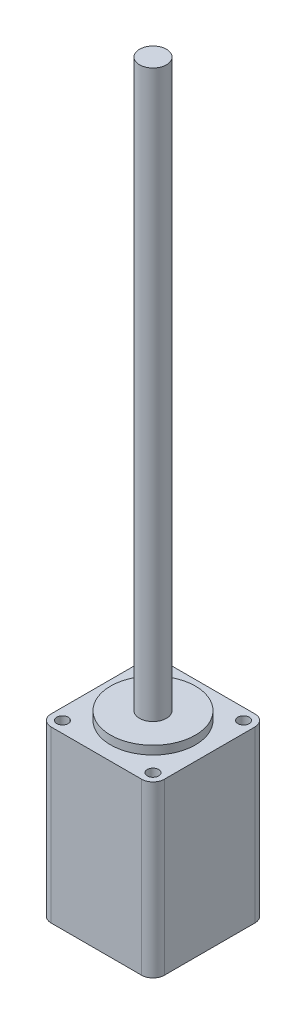
from build123d import *

# Parameters (mm, degrees)
SKETCH1_W           = 20
SKETCH1_H           = 20
BOSS_EXTRUDE1_DEPTH = 30
FILLET1_R           = 2
SKETCH2_R           = 1
CUT_EXTRUDE1_DEPTH  = 3
SKETCH3_R           = 7.5
BOSS_EXTRUDE2_DEPTH = 1.5
SKETCH4_R           = 2.38
BOSS_EXTRUDE3_DEPTH = 100


with BuildPart() as part:
    # Sketch1 → Boss-Extrude1 (new body)
    with BuildSketch(Plane(origin=(0, 0, 0), x_dir=(1, 0, 0), z_dir=(0, 1, 0))):
        Rectangle(SKETCH1_W, SKETCH1_H)
    extrude(amount=BOSS_EXTRUDE1_DEPTH)

    # Fillet1
    fillet1_edges = [part.edges().sort_by_distance(p)[0] for p in [
        (10, 15, 10),
        (-10, 15, 10),
        (-10, 15, -10),
        (10, 15, -10),
    ]]
    fillet(fillet1_edges, radius=FILLET1_R)

    # Sketch2 → Cut-Extrude1 (cut)
    with BuildSketch(Plane(origin=(0, 30, 0), x_dir=(1, 0, 0), z_dir=(0, 1, 0))):
        with Locations(Location((-8, 8, 0), (0, 0, 270))):
            Circle(SKETCH2_R)
        with Locations(Location((8, 8, 0), (0, 0, 270))):
            Circle(SKETCH2_R)
        with Locations(Location((8, -8, 0), (0, 0, 270))):
            Circle(SKETCH2_R)
        with Locations(Location((-8, -8, 0), (0, 0, 270))):
            Circle(SKETCH2_R)
    extrude(amount=-CUT_EXTRUDE1_DEPTH, mode=Mode.SUBTRACT)

    # Sketch3 → Boss-Extrude2 (add)
    with BuildSketch(Plane(origin=(0, 30, 0), x_dir=(1, 0, 0), z_dir=(0, 1, 0))):
        with Locations(Location((0, 0, 0), (0, 0, 90))):
            Circle(SKETCH3_R)
    extrude(amount=BOSS_EXTRUDE2_DEPTH)

    # Sketch4 → Boss-Extrude3 (add)
    with BuildSketch(Plane(origin=(0, 31.5, 0), x_dir=(1, 0, 0), z_dir=(0, 1, 0))):
        with Locations(Location((0, 0, 0), (0, 0, 270))):
            Circle(SKETCH4_R)
    extrude(amount=BOSS_EXTRUDE3_DEPTH)


solid = part.part
